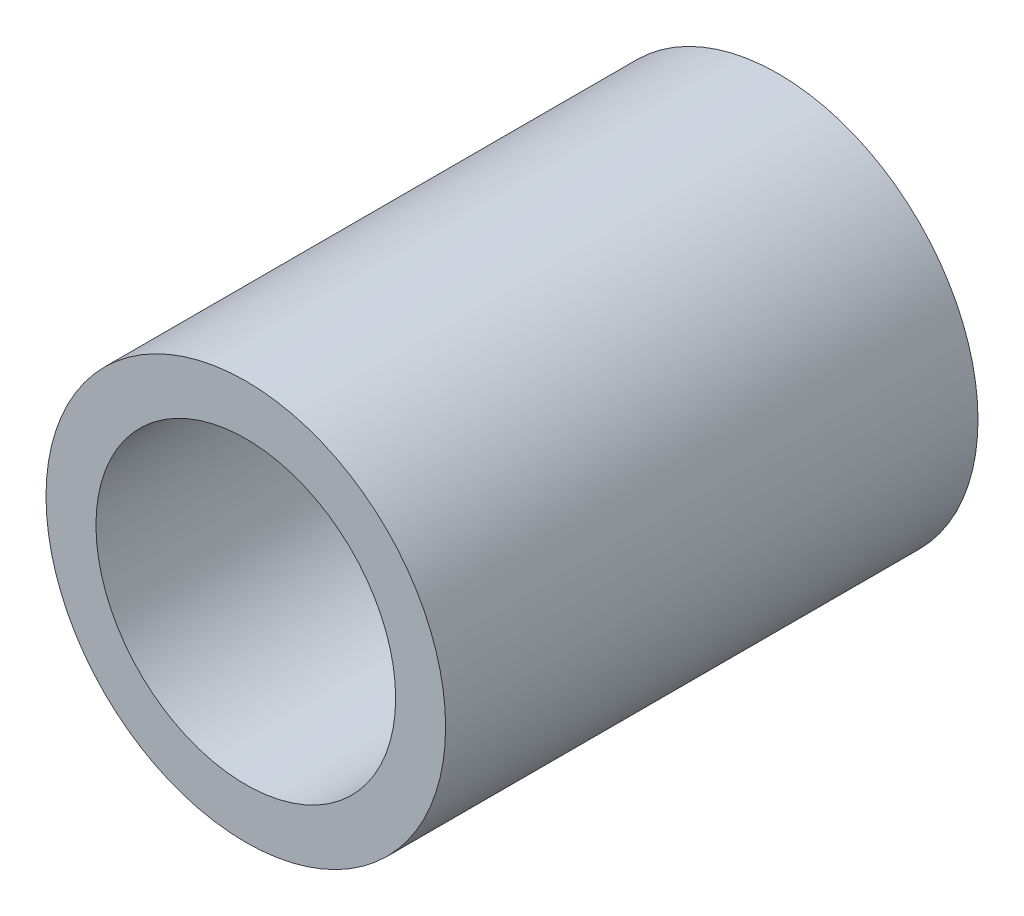
from build123d import *

# Parameters (mm, degrees)
SKETCH1_R           = 9.525
SKETCH1_R_2         = 7.14375
BOSS_EXTRUDE1_DEPTH = 25.38125


with BuildPart() as part:
    # Sketch1 → Boss-Extrude1 (new body)
    with BuildSketch(Plane.XY):
        Circle(SKETCH1_R)
        Circle(SKETCH1_R_2, mode=Mode.SUBTRACT)
    extrude(amount=BOSS_EXTRUDE1_DEPTH)


solid = part.part
